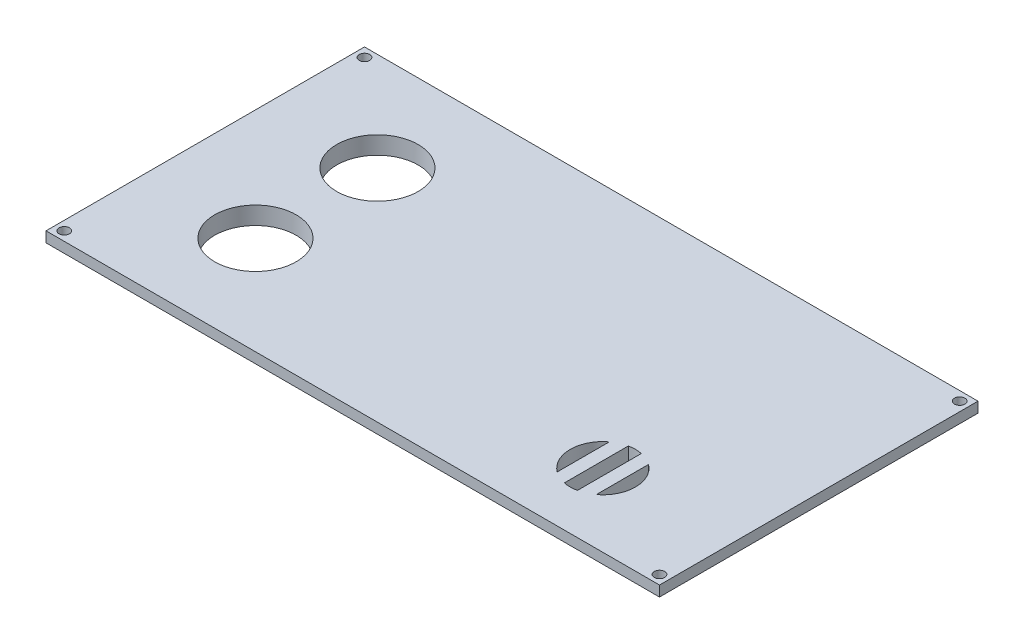
from build123d import *

# Parameters (mm, degrees)
ESBO_O18_W                 = 111.5
ESBO_O18_H                 = 54.5
RESSALTO_EXTRUS_O2_DEPTH   = 1.4
ESBO_O19_W                 = 117.5
ESBO_O19_H                 = 61
RESSALTO_EXTRUS_O3_DEPTH   = 2
ESBO_O24_R                 = 1
CORTE_EXTRUS_O1_DEPTH      = 86.215413827
CORTE_EXTRUS_O3_DEPTH      = 86.460885308
CORTE_EXTRUS_O3_DEPTH_BACK = 86.460885308
ESBO_O25_R                 = 7.8
ESBO_O25_R_2               = 4.186600547
CORTE_EXTRUS_O8_DEPTH      = 86.215413827


with BuildPart() as part:
    # Esboço18 → Ressalto-extrusão2 (new body)
    with BuildSketch(Plane(origin=(0, 0, 0), x_dir=(1, 0, 0), z_dir=(0, 1, 0))):
        with Locations((20.747526714, 0)):
            Rectangle(ESBO_O18_W, ESBO_O18_H)
    extrude(amount=RESSALTO_EXTRUS_O2_DEPTH)

    # Esboço19 → Ressalto-extrusão3 (add)
    with BuildSketch(Plane(origin=(0, 1.4, 0), x_dir=(1, 0, 0), z_dir=(0, 1, 0))):
        with Locations((20.747526714, 0)):
            Rectangle(ESBO_O19_W, ESBO_O19_H)
    extrude(amount=RESSALTO_EXTRUS_O3_DEPTH)

    # Esboço24 → Corte-extrusão1 (cut, through all)
    with BuildSketch(Plane(origin=(0, 3.4, 0), x_dir=(1, 0, 0), z_dir=(0, 1, 0))):
        with Locations(Location((-36.252473286, 28.75, 0), (0, 0, 270))):
            Circle(ESBO_O24_R)
        with Locations(Location((77.747526714, 28.75, 0), (0, 0, 270))):
            Circle(ESBO_O24_R)
        with Locations(Location((77.747526714, -28.75, 0), (0, 0, 270))):
            Circle(ESBO_O24_R)
        with Locations(Location((-36.25, -28.75, 0), (0, 0, 270))):
            Circle(ESBO_O24_R)
    extrude(amount=-CORTE_EXTRUS_O1_DEPTH, mode=Mode.SUBTRACT)

    # Esboço25 → Corte-extrusão3 (cut, two sides: drawn at the far end of the back side and taken through both)
    # profile 1 of 3: a face of its own
    with BuildSketch(Plane(origin=(0, 7.31137223, 0), x_dir=(1, 0, 0), z_dir=(0, 1, 0)).offset(-CORTE_EXTRUS_O3_DEPTH_BACK)):
        with Locations(Location((-16.682939742, 11.661108672, 0), (0, 0, 180))):
            Circle(ESBO_O25_R)
        with Locations((-16.682939742, 11.661108672)):
            Circle(ESBO_O25_R_2, mode=Mode.SUBTRACT)
    # profile 2 of 3: a face of its own
    with BuildSketch(Plane(origin=(0, 7.31137223, 0), x_dir=(1, 0, 0), z_dir=(0, 1, 0)).offset(-CORTE_EXTRUS_O3_DEPTH_BACK)):
        with Locations((-16.682939742, 11.661108672)):
            Circle(ESBO_O25_R_2)
    # profile 3 of 3: a face of its own
    with BuildSketch(Plane(origin=(0, 7.31137223, 0), x_dir=(1, 0, 0), z_dir=(0, 1, 0)).offset(-CORTE_EXTRUS_O3_DEPTH_BACK)):
        with Locations(Location((-16.710330787, -11.680669769, 0), (0, 0, 180))):
            Circle(ESBO_O25_R)
    extrude(amount=CORTE_EXTRUS_O3_DEPTH + CORTE_EXTRUS_O3_DEPTH_BACK, mode=Mode.SUBTRACT)

    # Esboço26 → Corte-extrusão8 (cut, through all)
    with BuildSketch(Plane(origin=(0, 0, 0), x_dir=(1, 0, 0), z_dir=(0, 1, 0))):
        with BuildLine():
            Line((58.447526714, -11.55), (58.447526714, -21.55))
            ThreePointArc((58.447526714, -21.55), (60.947526714, -16.55), (58.447526714, -11.55))
        make_face()
        with BuildLine():
            Line((55.947526714, -10.426275643), (55.947526714, -22.673724357))
            ThreePointArc((55.947526714, -22.673724357), (54.697526714, -22.8), (53.447526714, -22.673724357))
            Line((53.447526714, -22.673724357), (53.447526714, -10.426275643))
            ThreePointArc((53.447526714, -10.426275643), (54.697526714, -10.3), (55.947526714, -10.426275643))
        make_face()
        with BuildLine():
            Line((50.947526714, -11.55), (50.947526714, -21.55))
            ThreePointArc((50.947526714, -21.55), (48.447526714, -16.55), (50.947526714, -11.55))
        make_face()
    extrude(amount=CORTE_EXTRUS_O8_DEPTH, mode=Mode.SUBTRACT)


solid = part.part
